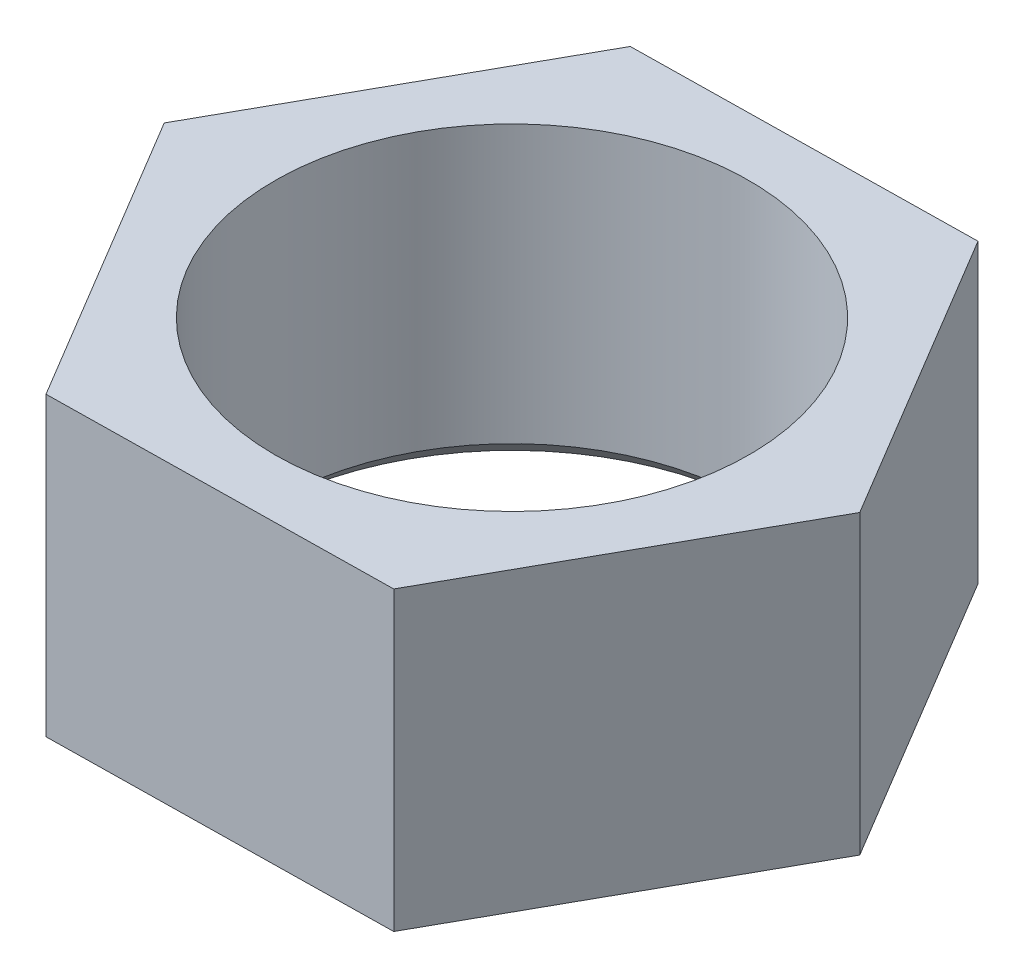
from build123d import *

# Parameters (mm, degrees)
BOSS_EXTRUDE1_DEPTH = 15
SKETCH2_R           = 12
CUT_EXTRUDE1_DEPTH  = 28.45639893
CHAMFER1_SIZE       = 1


with BuildPart() as part:
    # Sketch1 → Boss-Extrude1 (new body)
    with BuildSketch(Plane(origin=(0, 0, 0), x_dir=(1, 0, 0), z_dir=(0, 1, 0))):
        Polygon((8.887808978, -14.866299189), (17.318497247, 0.263918764), (8.430688269, 15.130217953), (-8.887808978, 14.866299189), (-17.318497247, -0.263918764), (-8.430688269, -15.130217953), align=None)
    extrude(amount=BOSS_EXTRUDE1_DEPTH)

    # Sketch2 → Cut-Extrude1 (cut, through all)
    with BuildSketch(Plane(origin=(0, 15, 0), x_dir=(1, 0, 0), z_dir=(0, 1, 0))):
        with Locations(Location((0, 0, 0), (0, 0, 270))):
            Circle(SKETCH2_R)
    extrude(amount=-CUT_EXTRUDE1_DEPTH, mode=Mode.SUBTRACT)

    # Chamfer1
    chamfer1_edges = [part.edges().sort_by_distance(p)[0] for p in [
        (0, 0, -12),
    ]]
    chamfer(chamfer1_edges, length=CHAMFER1_SIZE)


solid = part.part
